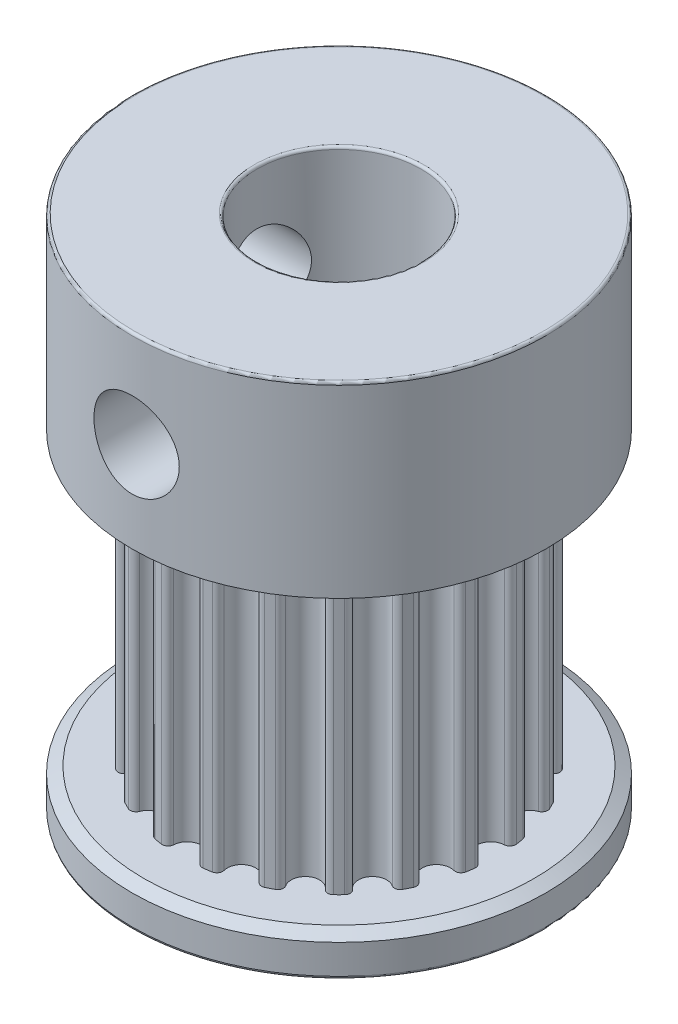
from build123d import *
from OCP.BRepFilletAPI import BRepFilletAPI_MakeChamfer

# Parameters (mm, degrees)
CUT_EXTRUDE1_DEPTH = 11
CIRPATTERN1_COUNT  = 20
CHAMFER1_SIZE      = 0.45
CHAMFER1_SIZE2     = 0.259807621
FILLET1_R          = 0.1
CIRPATTERN2_COUNT  = 2
CIRPATTERN2_ANGLE  = 90


with BuildPart() as part:
    # Sketch1 → Revolve1 (revolve)
    with BuildSketch(Plane.XY, mode=Mode.PRIVATE) as revolve1_sk:
        Polygon((3.175, 0), (3.175, 20), (8, 20), (8, 12.5), (6.11, 12.5), (6.11, 1.5), (8, 1.5), (8, 0), align=None)
    revolve(revolve1_sk.sketch.rotate(Axis((0, 0, 0), (0, 1, 0)), 90), axis=Axis((0, 0, 0), (0, 1, 0)))

    # Sketch2 → Cut-Extrude1 (cut)
    with BuildSketch(Plane(origin=(0, 1.5, 0), x_dir=(1, 0, 0), z_dir=(0, 1, 0))):
        with BuildLine():
            Line((-0.955814581, 6.034775761), (-1.004309266, 6.340959147))
            ThreePointArc((-1.004309266, 6.340959147), (0, 6.42), (1.004309266, 6.340959147))
            Line((1.004309266, 6.340959147), (0.955814581, 6.034775761))
            ThreePointArc((0.955814581, 6.034775761), (0.879939789, 6.04630515), (0.803926167, 6.056880609))
            ThreePointArc((0.803926167, 6.056880609), (0.629946584, 6.006472417), (0.549396106, 5.84423339))
            ThreePointArc((0.549396106, 5.84423339), (0, 5.32), (-0.549396106, 5.84423339))
            ThreePointArc((-0.549396106, 5.84423339), (-0.629946584, 6.006472417), (-0.803926167, 6.056880609))
            ThreePointArc((-0.803926167, 6.056880609), (-0.879939789, 6.04630515), (-0.955814581, 6.034775761))
        make_face()
    cut_extrude1 = extrude(amount=CUT_EXTRUDE1_DEPTH, mode=Mode.SUBTRACT)

    # CirPattern1: Cut-Extrude1 ×20 about axis
    cirpattern1_axis = Axis((0, 0, 0), (0, 1, 0))
    for i in range(1, CIRPATTERN1_COUNT):
        add(cut_extrude1.rotate(cirpattern1_axis, i * 360 / CIRPATTERN1_COUNT), mode=Mode.SUBTRACT)

    # Chamfer1: one chamfer whose edges measure the first distance from different faces: ONE call of the kernel's chamfer builder (chamfer() names one face for all edges)
    chamfer1_edges_1 = [part.edges().sort_by_distance(p)[0] for p in [
        (0, 12.5, 8),
    ]]
    chamfer1_side_1 = [part.faces().sort_by_distance(p)[0] for p in [
        (0, 12.5, 7.77372583),
    ]]
    chamfer1_edges_2 = [part.edges().sort_by_distance(p)[0] for p in [
        (0, 1.5, 8),
    ]]
    chamfer1_side_2 = [part.faces().sort_by_distance(p)[0] for p in [
        (0, 1.5, 7.77372583),
    ]]
    chamfer1 = BRepFilletAPI_MakeChamfer(part.part.solid().wrapped)
    for e in chamfer1_edges_1:
        chamfer1.Add(CHAMFER1_SIZE, CHAMFER1_SIZE2, e.wrapped, chamfer1_side_1[0].wrapped)  # the first distance lies on this face
    for e in chamfer1_edges_2:
        chamfer1.Add(CHAMFER1_SIZE, CHAMFER1_SIZE2, e.wrapped, chamfer1_side_2[0].wrapped)  # the first distance lies on this face
    add(Compound.cast(chamfer1.Shape()), mode=Mode.REPLACE)

    # Fillet1
    fillet1_edges = [part.edges().sort_by_distance(p)[0] for p in [
        (0, 0, 8),
        (0, 0, 3.175),
        (0, 20, 3.175),
        (0, 20, 8),
    ]]
    fillet(fillet1_edges, radius=FILLET1_R)

    # Sketch6 → M4 Tapped Hole2 (revolve, cut)
    with BuildSketch(Plane(origin=(0, 16.25, 8), x_dir=(0, -1, 0), z_dir=(1, 0, 0))):
        Polygon((0, 0), (0, 6.5), (1.65, 5.508579979), (1.65, 0), align=None)
    m4_tapped_hole2 = revolve(axis=Axis((0, 16.25, 14.35), (0, 0, -1)), mode=Mode.SUBTRACT)

    # CirPattern2: M4 Tapped Hole2 ×2 about axis
    cirpattern2_axis = Axis((0, 19.9, 0), (0, -1, 0))
    for i in range(1, CIRPATTERN2_COUNT):
        add(m4_tapped_hole2.rotate(cirpattern2_axis, i * CIRPATTERN2_ANGLE / (CIRPATTERN2_COUNT - 1)), mode=Mode.SUBTRACT)


solid = part.part
